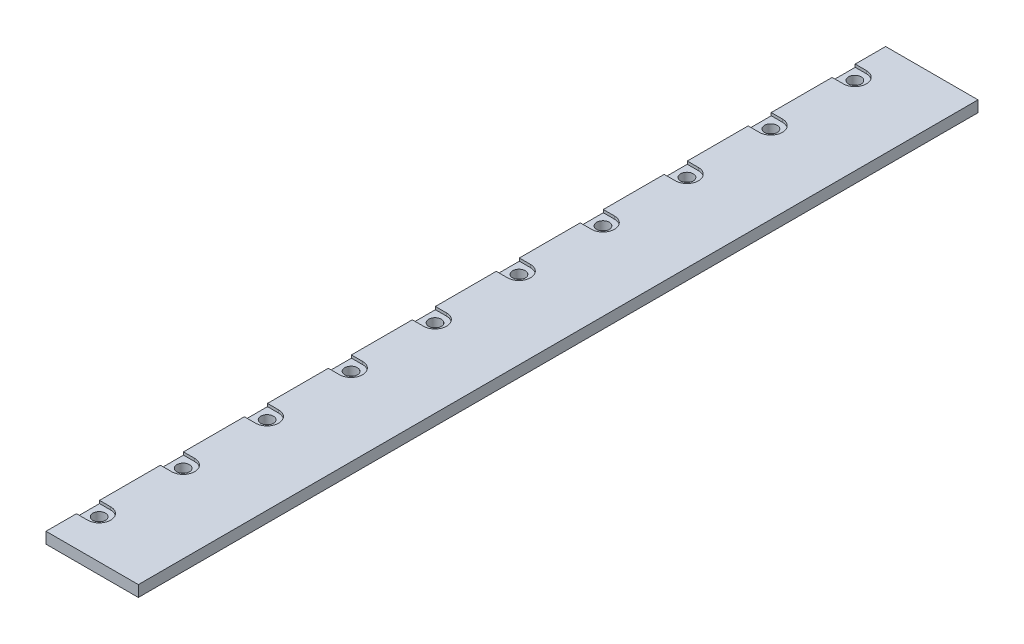
from build123d import *

# Parameters (mm, degrees)
SKETCH1_W           = 33
SKETCH1_H           = 4
BOSS_EXTRUDE2_DEPTH = 300
CUT_EXTRUDE2_DEPTH  = 1
SKETCH5_R           = 2.25
CUT_EXTRUDE3_DEPTH  = 301.46838436
LPATTERN1_COUNT     = 10
LPATTERN1_PITCH     = 30


with BuildPart() as part:
    # Sketch1 → Boss-Extrude2 (new body)
    with BuildSketch(Plane.XY):
        Rectangle(SKETCH1_W, SKETCH1_H)
    extrude(amount=BOSS_EXTRUDE2_DEPTH)

    # Sketch2 → Cut-Extrude2 (cut)
    with BuildSketch(Plane(origin=(0, 2, 0), x_dir=(1, 0, 0), z_dir=(0, 1, 0))):
        with BuildLine():
            Line((-12.5, -10.875), (-16.5, -10.875))
            Line((-16.5, -10.875), (-16.5, -19.125))
            Line((-16.5, -19.125), (-12.5, -19.125))
            ThreePointArc((-12.5, -19.125), (-8.375, -15), (-12.5, -10.875))
        make_face()
    cut_extrude2 = extrude(amount=-CUT_EXTRUDE2_DEPTH, mode=Mode.SUBTRACT)

    # Sketch5 → Cut-Extrude3 (cut, through all)
    with BuildSketch(Plane(origin=(0, 1, 0), x_dir=(1, 0, 0), z_dir=(0, 1, 0))):
        with Locations(Location((-12.5, -15, 0), (0, 0, 270))):
            Circle(SKETCH5_R)
    cut_extrude3 = extrude(amount=-CUT_EXTRUDE3_DEPTH, mode=Mode.SUBTRACT)

    # LPattern1: Cut-Extrude2, Cut-Extrude3 ×10
    with Locations(*[(0, 0, i * LPATTERN1_PITCH) for i in range(1, LPATTERN1_COUNT)]):
        add(cut_extrude2, mode=Mode.SUBTRACT)
        add(cut_extrude3, mode=Mode.SUBTRACT)


solid = part.part
